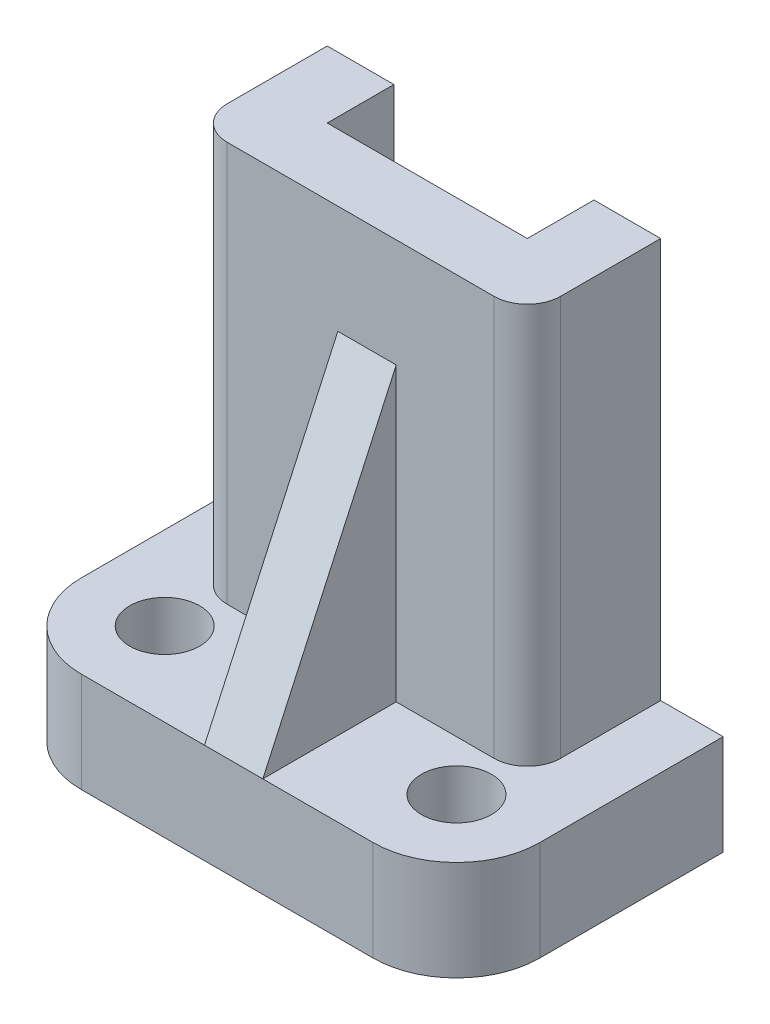
from build123d import *

# Parameters (mm, degrees)
IZIM1_W                     = 40
IZIM1_H                     = 48
Y_KSEKLIK_EKSTR_ZYON1_DEPTH = 16
RADYUS4_R                   = 4
IZIM5_W                     = 24
IZIM5_H                     = 8
KES_EKSTR_ZYON1_DEPTH       = 59
IZIM6_W                     = 55
IZIM6_H                     = 32
Y_KSEKLIK_EKSTR_ZYON4_DEPTH = 12
RADYUS7_R                   = 10
IZIM9_R                     = 4.2
KES_EKSTR_ZYON2_DEPTH       = 21
IZIM10_W                    = 7
IZIM10_H                    = 35
Y_KSEKLIK_EKSTR_ZYON5_DEPTH = 16
KES_EKSTR_ZYON3_DEPTH       = 16


with BuildPart() as part:
    # Çizim1 → Yükseklik-Ekstrüzyon1 (new body)
    with BuildSketch(Plane.XY):
        with Locations((-20, 24)):
            Rectangle(IZIM1_W, IZIM1_H)
    extrude(amount=Y_KSEKLIK_EKSTR_ZYON1_DEPTH)

    # Radyus4
    radyus4_edges = [part.edges().sort_by_distance(p)[0] for p in [
        (-40, 24, 16),
        (0, 24, 16),
    ]]
    fillet(radyus4_edges, radius=RADYUS4_R)

    # Çizim5 → Kes-Ekstrüzyon1 (cut)
    with BuildSketch(Plane(origin=(0, 48, 0), x_dir=(1, 0, 0), z_dir=(0, 1, 0))):
        with Locations((-20, -4)):
            Rectangle(IZIM5_W, IZIM5_H)
    extrude(amount=-KES_EKSTR_ZYON1_DEPTH, mode=Mode.SUBTRACT)

    # Çizim6 → Yükseklik-Ekstrüzyon4 (add)
    with BuildSketch(Plane.XZ):
        with Locations((-20, 16)):
            Rectangle(IZIM6_W, IZIM6_H)
    extrude(amount=Y_KSEKLIK_EKSTR_ZYON4_DEPTH)

    # Radyus7
    radyus7_edges = [part.edges().sort_by_distance(p)[0] for p in [
        (7.5, -6, 32),
        (-47.5, -6, 32),
    ]]
    fillet(radyus7_edges, radius=RADYUS7_R)

    # Çizim9 → Kes-Ekstrüzyon2 (cut)
    with BuildSketch(Plane.XZ.offset(12)):
        with Locations((-37.5, 22)):
            Circle(IZIM9_R)
        with Locations((-2.5, 22)):
            Circle(IZIM9_R)
    extrude(amount=-KES_EKSTR_ZYON2_DEPTH, mode=Mode.SUBTRACT)

    # Çizim10 → Yükseklik-Ekstrüzyon5 (add)
    with BuildSketch(Plane.XY.offset(16)):
        with Locations((-19.227636849, 17.5)):
            Rectangle(IZIM10_W, IZIM10_H)
    extrude(amount=Y_KSEKLIK_EKSTR_ZYON5_DEPTH)

    # Çizim11 → Kes-Ekstrüzyon3 (cut)
    with BuildSketch(Plane(origin=(-15.727636849, 0, 0), x_dir=(0, 0, -1), z_dir=(1, 0, 0))):
        Polygon((-16, 35), (-32, 0), (-32, 35), align=None)
    extrude(amount=-KES_EKSTR_ZYON3_DEPTH, mode=Mode.SUBTRACT)


solid = part.part
